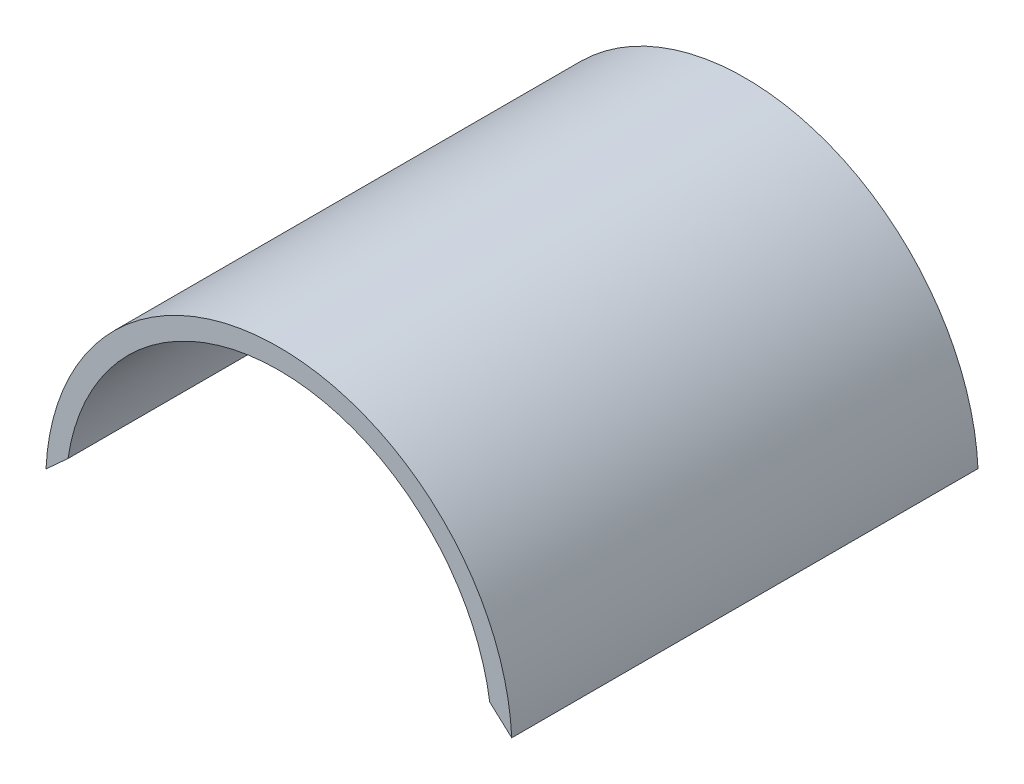
from build123d import *

# Parameters (mm, degrees)
BOSS_EXTRUDE1_DEPTH = 88.9


with BuildPart() as part:
    # Sketch1 → Boss-Extrude1 (new body)
    with BuildSketch(Plane.XY):
        with BuildLine():
            Line((-40.203883769, 5.937788296), (-44.399042974, 2.127788296))
            ThreePointArc((-44.399042974, 2.127788296), (0, 44.45), (44.399042974, 2.127788296))
            Line((44.399042974, 2.127788296), (40.203883769, 5.937788296))
            ThreePointArc((40.203883769, 5.937788296), (0, 40.64), (-40.203883769, 5.937788296))
        make_face()
    extrude(amount=BOSS_EXTRUDE1_DEPTH)


solid = part.part
